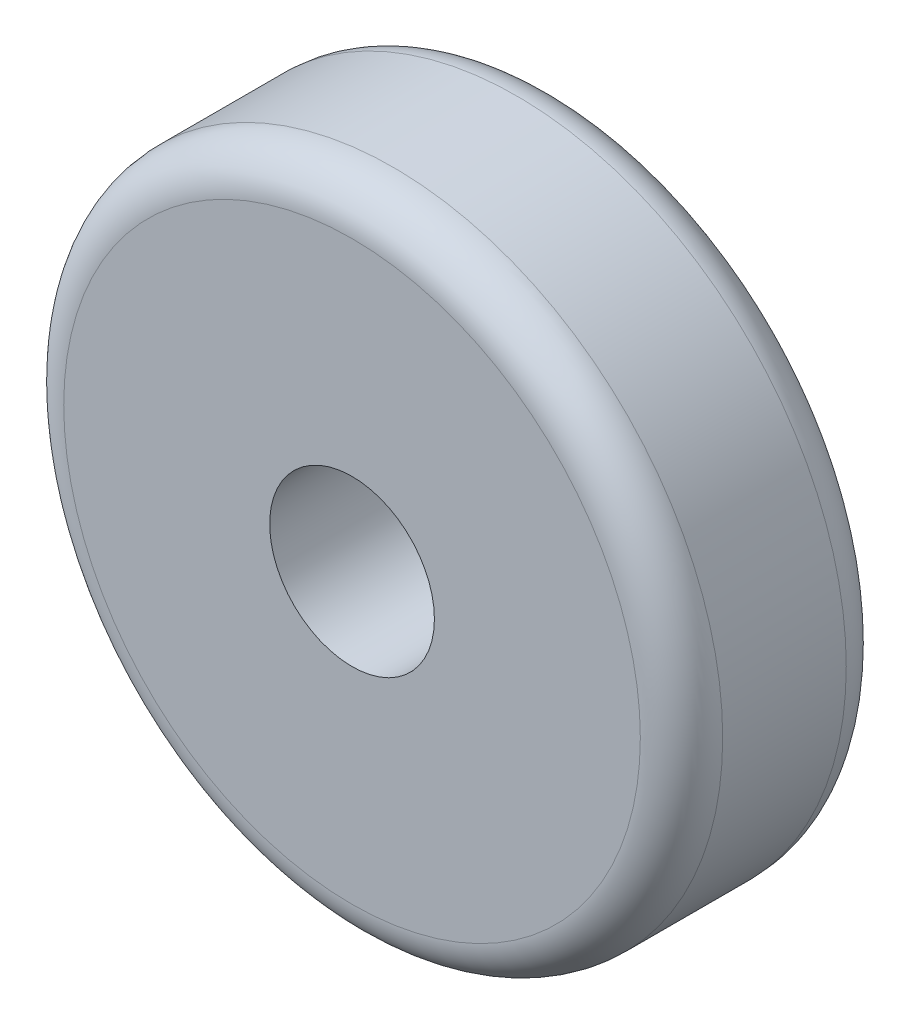
from build123d import *

# Parameters (mm, degrees)
SKETCH_1_R      = 8
SKETCH_1_R_2    = 2
EXTRUDE_1_DEPTH = 5
FILLET_1_R      = 1


with BuildPart() as part:
    # 草图1 → 凸台-拉伸1 (new body)
    with BuildSketch(Plane.XY):
        Circle(SKETCH_1_R)
        Circle(SKETCH_1_R_2, mode=Mode.SUBTRACT)
    extrude(amount=EXTRUDE_1_DEPTH)

    # 圆角1
    fillet_1_edges = [part.edges().sort_by_distance(p)[0] for p in [
        (-8, 0, 0),
        (-8, 0, 5),
    ]]
    fillet(fillet_1_edges, radius=FILLET_1_R)


solid = part.part
